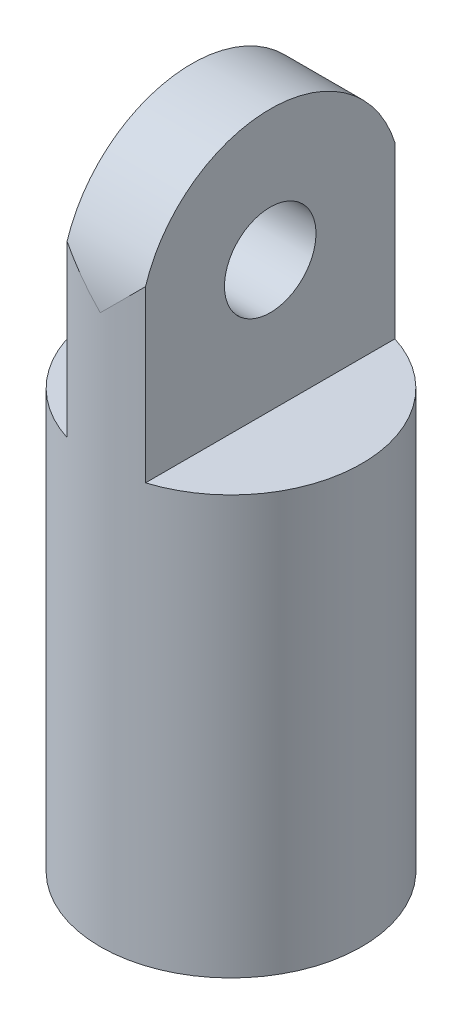
from build123d import *

# Parameters (mm, degrees)
SKETCH1_R               = 5
SKETCH1_R_2             = 3.1
BOSS_EXTRUDE1_DEPTH     = 15
SKETCH2_R               = 5
BOSS_EXTRUDE2_DEPTH     = 1
BOSS_EXTRUDE3_DEPTH     = 10
SKETCH5_R               = 1.75
CUT_EXTRUDE1_DEPTH      = 28.26261176
CUT_EXTRUDE2_DEPTH      = 27.944387171
CUT_EXTRUDE2_DEPTH_BACK = 27.944387171


with BuildPart() as part:
    # Sketch1 → Boss-Extrude1 (new body)
    with BuildSketch(Plane(origin=(0, 0, 0), x_dir=(1, 0, 0), z_dir=(0, 1, 0))):
        with Locations(Location((0, 0, 0), (0, 0, 270))):
            Circle(SKETCH1_R)
        with Locations(Location((0, 0, 0), (0, 0, 270))):
            Circle(SKETCH1_R_2, mode=Mode.SUBTRACT)
    extrude(amount=BOSS_EXTRUDE1_DEPTH)

    # Sketch2 → Boss-Extrude2 (add)
    with BuildSketch(Plane(origin=(0, 15, 0), x_dir=(1, 0, 0), z_dir=(0, 1, 0))):
        with Locations(Location((0, 0, 0), (0, 0, 270))):
            Circle(SKETCH2_R)
    extrude(amount=BOSS_EXTRUDE2_DEPTH)

    # Sketch4 → Boss-Extrude3 (add)
    with BuildSketch(Plane(origin=(0, 16, 0), x_dir=(1, 0, 0), z_dir=(0, 1, 0))):
        with BuildLine():
            Line((-1.5, 4.769696007), (-1.5, -4.769696007))
            ThreePointArc((-1.5, -4.769696007), (0, -5), (1.5, -4.769696007))
            Line((1.5, -4.769696007), (1.5, 4.769696007))
            ThreePointArc((1.5, 4.769696007), (0, 5), (-1.5, 4.769696007))
        make_face()
    extrude(amount=BOSS_EXTRUDE3_DEPTH)

    # Sketch5 → Cut-Extrude1 (cut, through all)
    with BuildSketch(Plane.ZY.offset(1.5)):
        with Locations((0, 21)):
            Circle(SKETCH5_R)
    extrude(amount=-CUT_EXTRUDE1_DEPTH, mode=Mode.SUBTRACT)

    # Sketch6 → Cut-Extrude2 (cut, two sides: drawn at the far end of the back side and taken through both)
    with BuildSketch(Plane(origin=(0, 0, 0), x_dir=(0, 0, -1), z_dir=(1, 0, 0)).offset(-CUT_EXTRUDE2_DEPTH_BACK)):
        with BuildLine():
            Line((-5, 21), (-5, 26.951981281))
            Line((-5, 26.951981281), (5, 26.951981281))
            Line((5, 26.951981281), (5, 21))
            ThreePointArc((5, 21), (0, 26), (-5, 21))
        make_face()
    extrude(amount=CUT_EXTRUDE2_DEPTH + CUT_EXTRUDE2_DEPTH_BACK, mode=Mode.SUBTRACT)


solid = part.part
